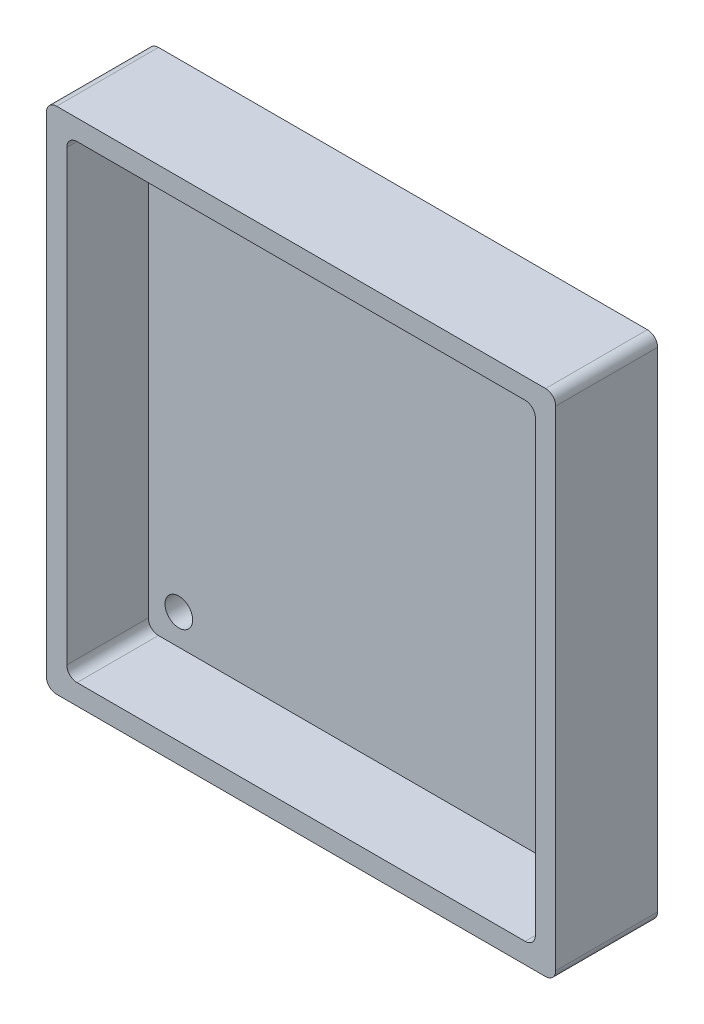
from build123d import *

# Parameters (mm, degrees)
SKETCH1_W           = 100
SKETCH1_H           = 100
BOSS_EXTRUDE1_DEPTH = 20
SKETCH2_W           = 92
SKETCH2_H           = 92
CUT_EXTRUDE1_DEPTH  = 16
FILLET1_R           = 2
SKETCH3_R           = 2.713966801
CUT_EXTRUDE2_DEPTH  = 16


with BuildPart() as part:
    # Sketch1 → Boss-Extrude1 (new body)
    with BuildSketch(Plane.XY):
        Rectangle(SKETCH1_W, SKETCH1_H)
    extrude(amount=BOSS_EXTRUDE1_DEPTH)

    # Sketch2 → Cut-Extrude1 (cut)
    with BuildSketch(Plane.XY.offset(20)):
        Rectangle(SKETCH2_W, SKETCH2_H)
    extrude(amount=-CUT_EXTRUDE1_DEPTH, mode=Mode.SUBTRACT)

    # Fillet1
    fillet1_edges = [part.edges().sort_by_distance(p)[0] for p in [
        (-46, -46, 12),
        (-46, 46, 12),
        (46, 46, 12),
        (46, -46, 12),
        (-50, 50, 10),
        (50, 50, 10),
        (50, -50, 10),
        (-50, -50, 10),
    ]]
    fillet(fillet1_edges, radius=FILLET1_R)

    # Sketch3 → Cut-Extrude2 (cut)
    with BuildSketch(Plane.XY):
        with Locations((-40, 40)):
            Circle(SKETCH3_R)
        with Locations((40, 40)):
            Circle(SKETCH3_R)
        with Locations((40, -40)):
            Circle(SKETCH3_R)
        with Locations((-40, -40)):
            Circle(SKETCH3_R)
    extrude(amount=CUT_EXTRUDE2_DEPTH, mode=Mode.SUBTRACT)


solid = part.part
